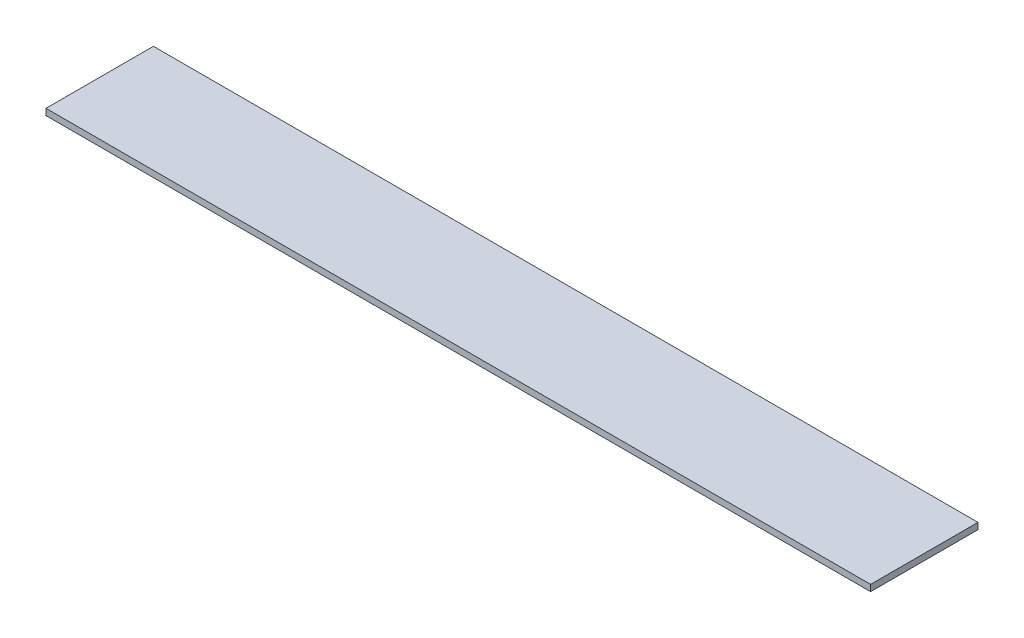
from build123d import *

# Parameters (mm, degrees)
CROQUIS1_W              = 390
CROQUIS1_H              = 3
SALIENTE_EXTRUIR1_DEPTH = 50.8


with BuildPart() as part:
    # Croquis1 → Saliente-Extruir1 (new body)
    with BuildSketch(Plane.XY):
        Rectangle(CROQUIS1_W, CROQUIS1_H)
    extrude(amount=SALIENTE_EXTRUIR1_DEPTH)


solid = part.part
